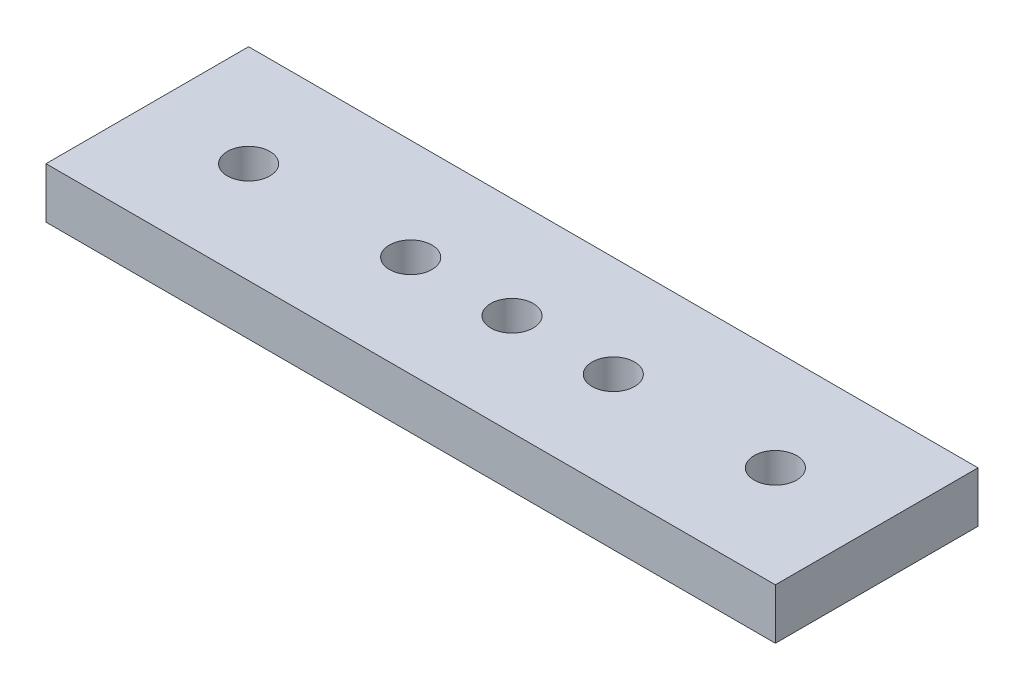
from build123d import *

# Parameters (mm, degrees)
SKETCH_1_W      = 72
SKETCH_1_H      = 20
SKETCH_1_R      = 2.1
EXTRUDE_1_DEPTH = 5


with BuildPart() as part:
    # 草图1 → 凸台-拉伸1 (new body)
    with BuildSketch(Plane.XZ.offset(5)):
        with Locations((0, 10)):
            Rectangle(SKETCH_1_W, SKETCH_1_H)
        with Locations(Location((10, 10, 0), (0, 0, 90))):
            Circle(SKETCH_1_R, mode=Mode.SUBTRACT)
        with Locations(Location((26, 10, 0), (0, 0, 90))):
            Circle(SKETCH_1_R, mode=Mode.SUBTRACT)
        with Locations(Location((-10, 10, 0), (0, 0, 90))):
            Circle(SKETCH_1_R, mode=Mode.SUBTRACT)
        with Locations(Location((-26, 10, 0), (0, 0, 90))):
            Circle(SKETCH_1_R, mode=Mode.SUBTRACT)
        with Locations(Location((0, 10, 0), (0, 0, 90))):
            Circle(SKETCH_1_R, mode=Mode.SUBTRACT)
    extrude(amount=-EXTRUDE_1_DEPTH)


solid = part.part
